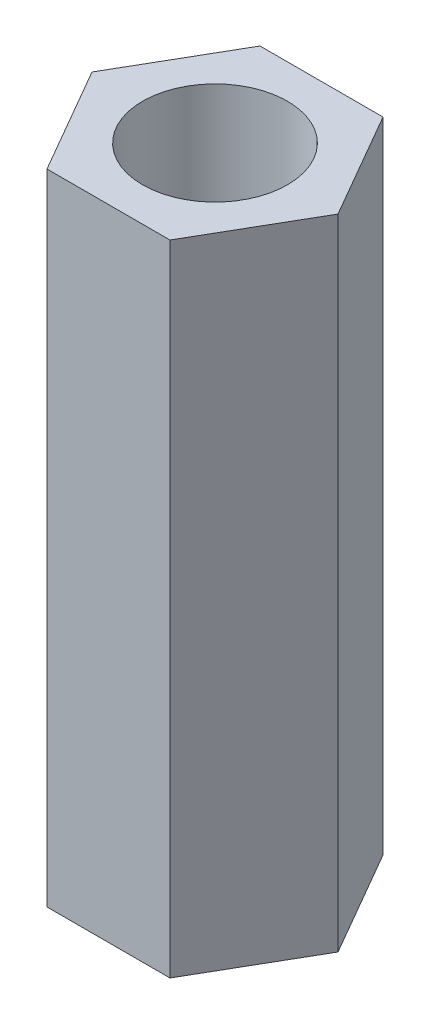
from build123d import *

# Parameters (mm, degrees)
SKETCH_1_R      = 1.7
EXTRUDE_1_DEPTH = 15


with BuildPart() as part:
    # 草图1 → 凸台-拉伸1 (new body)
    with BuildSketch(Plane(origin=(0, 0, 0), x_dir=(1, 0, 0), z_dir=(0, 1, 0))):
        Polygon((2.886751346, 0), (1.443375673, 2.5), (-1.443375673, 2.5), (-2.886751346, 0), (-1.443375673, -2.5), (1.443375673, -2.5), align=None)
        with Locations(Location((0, 0, 0), (0, 0, 270))):
            Circle(SKETCH_1_R, mode=Mode.SUBTRACT)
    extrude(amount=EXTRUDE_1_DEPTH)


solid = part.part
